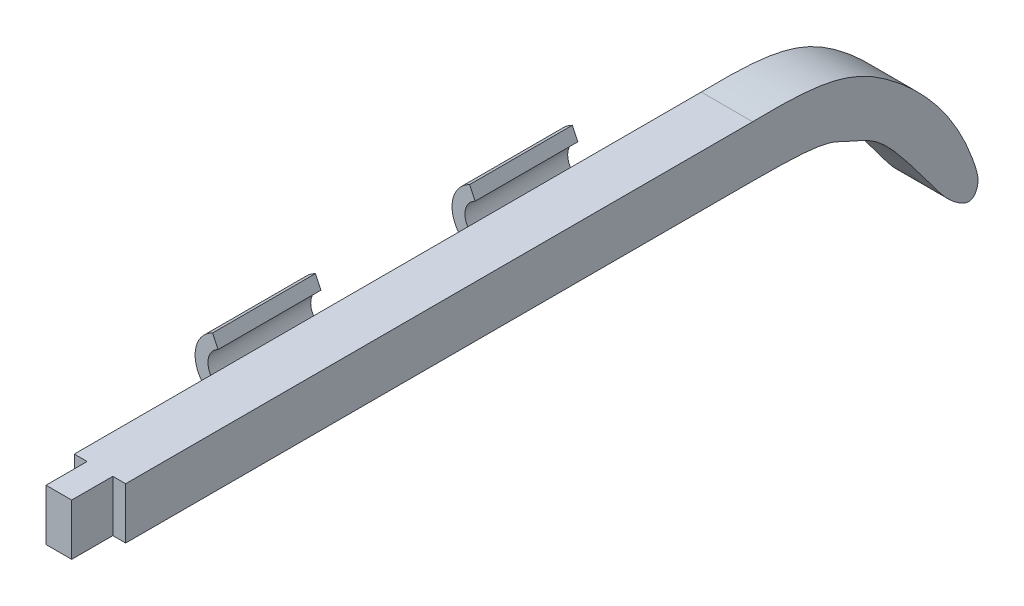
from build123d import *

# Parameters (mm, degrees)
BOSS_EXTRUDE1_DEPTH = 10
BOSS_EXTRUDE2_DEPTH = 10
SKETCH7_W           = 2.5
SKETCH7_H           = 10
CUT_EXTRUDE1_DEPTH  = 8


with BuildPart() as part:
    # Sketch3 → Boss-Extrude1 (new body)
    with BuildSketch(Plane(origin=(0, 0, 0), x_dir=(0, 0, -1), z_dir=(1, 0, 0))):
        with BuildLine():
            Line((0, 10), (130, 10))
            add(Edge.make_bspline(
                [(130, 10), (143.257831062, 10.295968591), (152.362580677, 8.411339369), (167.478605766, -5.773344354), (172.615930834, -16.282094646), (174.074786887, -21.87323482), (172.857902226, -25.275077888), (168.561594529, -23.155195651), (157.061538089, -7.448521863), (154.600537824, -5.126556057), (145.232328073, -1.239475242), (144.477420142, 0), (130, 0)],
                knots=[0, 0, 0, 0, 0.101519052, 0.157910707, 0.21054164, 0.223356202, 0.228060175, 0.254301241, 0.299209562, 0.632235058, 0.706476921, 1, 1, 1, 1], degree=3))
            Line((130, 0), (0, 0))
            Line((0, 0), (0, 10))
        make_face()
    extrude(amount=BOSS_EXTRUDE1_DEPTH)

    # Sketch6 → Boss-Extrude2 (add, symmetric)
    with BuildSketch(Plane.XY.offset(-50)):
        with BuildLine():
            ThreePointArc((-4.226853891, 3.418947262), (-5.988961939, 6.586361429), (-4, 9.616471606))
            Line((-4, 9.616471606), (-5.07763977, 11.872284658))
            ThreePointArc((-5.07763977, 11.872284658), (-5.515021958, 11.640720009), (-5.931832337, 11.373897083))
            ThreePointArc((-5.931832337, 11.373897083), (-7.699921372, 3.480027032), (0, 1))
            Line((0, 1), (0, 4))
            ThreePointArc((0, 4), (-2.014652581, 2.990941934), (-4.226853891, 3.418947262))
        make_face()
    boss_extrude2 = extrude(amount=BOSS_EXTRUDE2_DEPTH, both=True)

    # Mirror4: Boss-Extrude2 across plane
    add(boss_extrude2.mirror(Plane.XY.offset(-75)))

    # Sketch7 → Cut-Extrude1 (cut)
    with BuildSketch(Plane.XY):
        with Locations((8.75, 5)):
            Rectangle(SKETCH7_W, SKETCH7_H)
        with Locations((1.25, 5)):
            Rectangle(SKETCH7_W, SKETCH7_H)
    extrude(amount=-CUT_EXTRUDE1_DEPTH, mode=Mode.SUBTRACT)


solid = part.part
